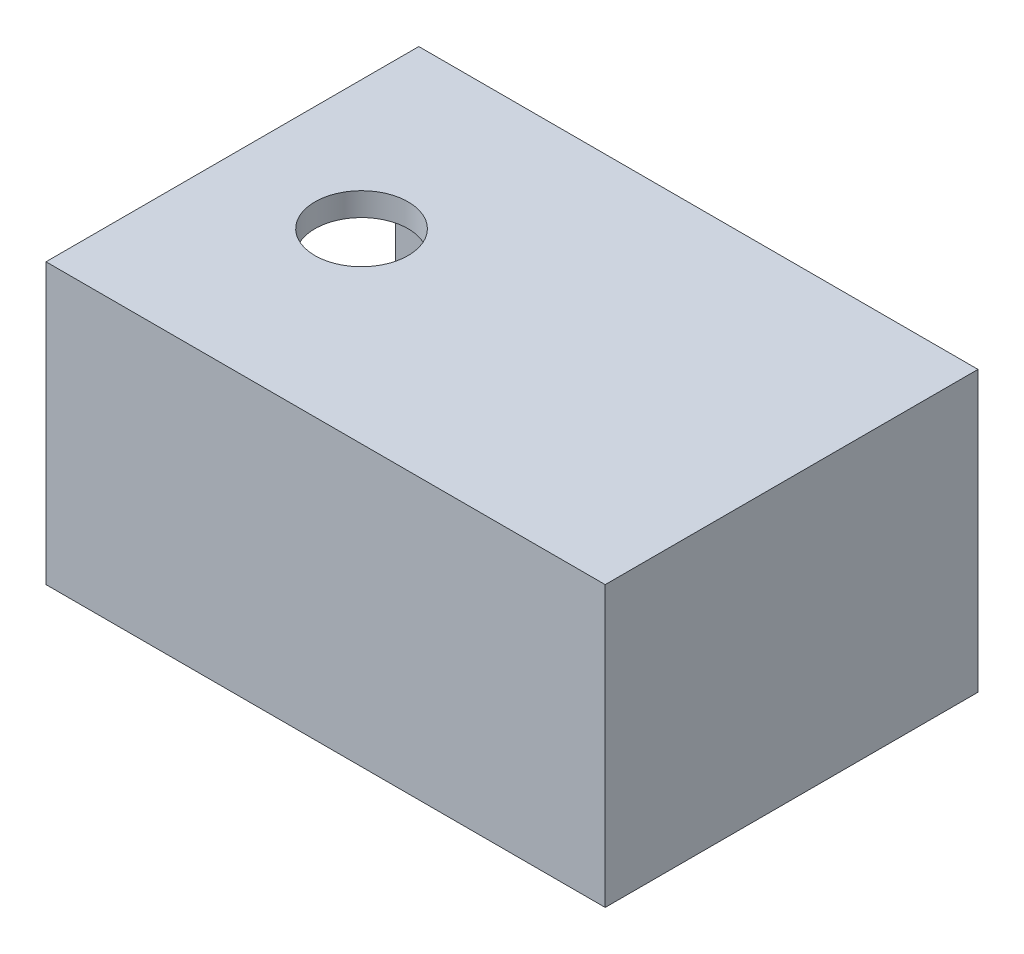
from build123d import *

# Parameters (mm, degrees)
SKETCH1_W           = 60
SKETCH1_H           = 40
BOSS_EXTRUDE1_DEPTH = 30
SKETCH2_OUTSIDE_W   = 57.62
SKETCH2_OUTSIDE_H   = 47.62
SKETCH2_OUTSIDE_W_2 = 40
SKETCH2_OUTSIDE_H_2 = 30
SKETCH2_OUTSIDE_W_3 = 35
SKETCH2_OUTSIDE_H_3 = 25
CUT_EXTRUDE1_DEPTH  = 57.5
SKETCH3_R           = 2.5
CUT_EXTRUDE2_DEPTH  = 57.5
FILLET1_R           = 1
SKETCH4_R           = 5
CUT_EXTRUDE3_DEPTH  = 20


with BuildPart() as part:
    # Sketch1 → Boss-Extrude1 (new body)
    with BuildSketch(Plane(origin=(0, 0, 0), x_dir=(1, 0, 0), z_dir=(0, 1, 0))):
        with Locations((-10.610539169, 2.437108943)):
            Rectangle(SKETCH1_W, SKETCH1_H)
    extrude(amount=BOSS_EXTRUDE1_DEPTH)

    # Sketch2 outside → Cut-Extrude1 (cut)
    # profile 1 of 2: a face of its own
    with BuildSketch(Plane.ZY.offset(40.610539169)):
        with Locations((-2.437, 15)):
            Rectangle(SKETCH2_OUTSIDE_W, SKETCH2_OUTSIDE_H)
        with Locations((-2.437108943, 15)):
            Rectangle(SKETCH2_OUTSIDE_W_2, SKETCH2_OUTSIDE_H_2, mode=Mode.SUBTRACT)
    # profile 2 of 2: a face of its own
    with BuildSketch(Plane.ZY.offset(40.610539169)):
        with Locations((-2.437108943, 15)):
            Rectangle(SKETCH2_OUTSIDE_W_3, SKETCH2_OUTSIDE_H_3)
    extrude(amount=-CUT_EXTRUDE1_DEPTH, mode=Mode.SUBTRACT)

    # Sketch3 → Cut-Extrude2 (cut)
    with BuildSketch(Plane(origin=(0, 30, 0), x_dir=(1, 0, 0), z_dir=(0, 1, 0))):
        with Locations(Location((-26.75468652, 2.437108943, 0), (0, 0, 270))):
            Circle(SKETCH3_R)
    extrude(amount=-CUT_EXTRUDE2_DEPTH, mode=Mode.SUBTRACT)

    # Fillet1
    fillet1_edges = [part.edges().sort_by_distance(p)[0] for p in [
        (-26.75468652, 2.5, -4.937108943),
    ]]
    fillet(fillet1_edges, radius=FILLET1_R)

    # Sketch4 → Cut-Extrude3 (cut)
    with BuildSketch(Plane(origin=(0, 30, 0), x_dir=(1, 0, 0), z_dir=(0, 1, 0))):
        with Locations(Location((-26.75468652, 2.437108943, 0), (0, 0, 270))):
            Circle(SKETCH4_R)
    extrude(amount=-CUT_EXTRUDE3_DEPTH, mode=Mode.SUBTRACT)


solid = part.part
